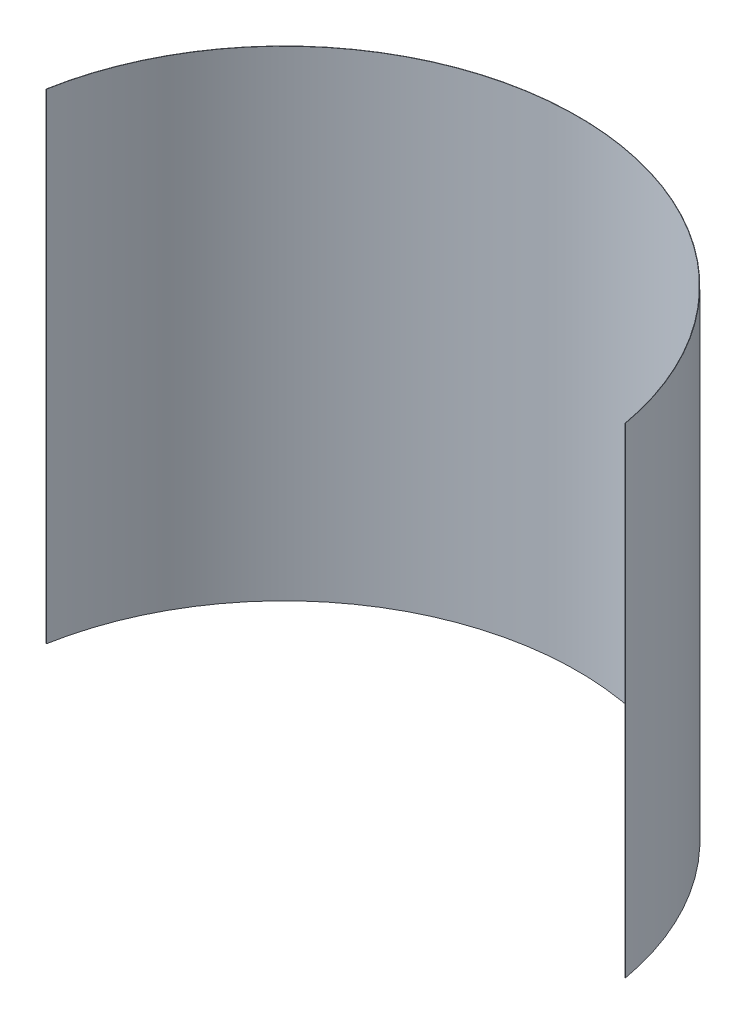
from build123d import *

# Parameters (mm, degrees)
SURFACE_EXTRUDE1_1_BACK  = 1743
SURFACE_EXTRUDE1_1_DEPTH = 1743
THICKEN1_T2              = 1


with BuildPart() as body_1:
    # Surface-Extrude1: a surface, the sketch's curves swept straight by 1743 mm
    with BuildLine(Plane(origin=(0, 0, 0), x_dir=(1, 0, 0), z_dir=(0, 1, 0)).offset(-SURFACE_EXTRUDE1_1_BACK), mode=Mode.PRIVATE) as surface_extrude1_1_path:
        ThreePointArc((16.790883176, 188.6), (1067.6, 1067.6), (2118.409116824, 188.6))
    surface_extrude1_1 = Shell.extrude(surface_extrude1_1_path.wire(), (0 * SURFACE_EXTRUDE1_1_DEPTH, 1 * SURFACE_EXTRUDE1_1_DEPTH, 0 * SURFACE_EXTRUDE1_1_DEPTH))
    add(Solid.thicken(surface_extrude1_1, -THICKEN1_T2))


solid = body_1.part
